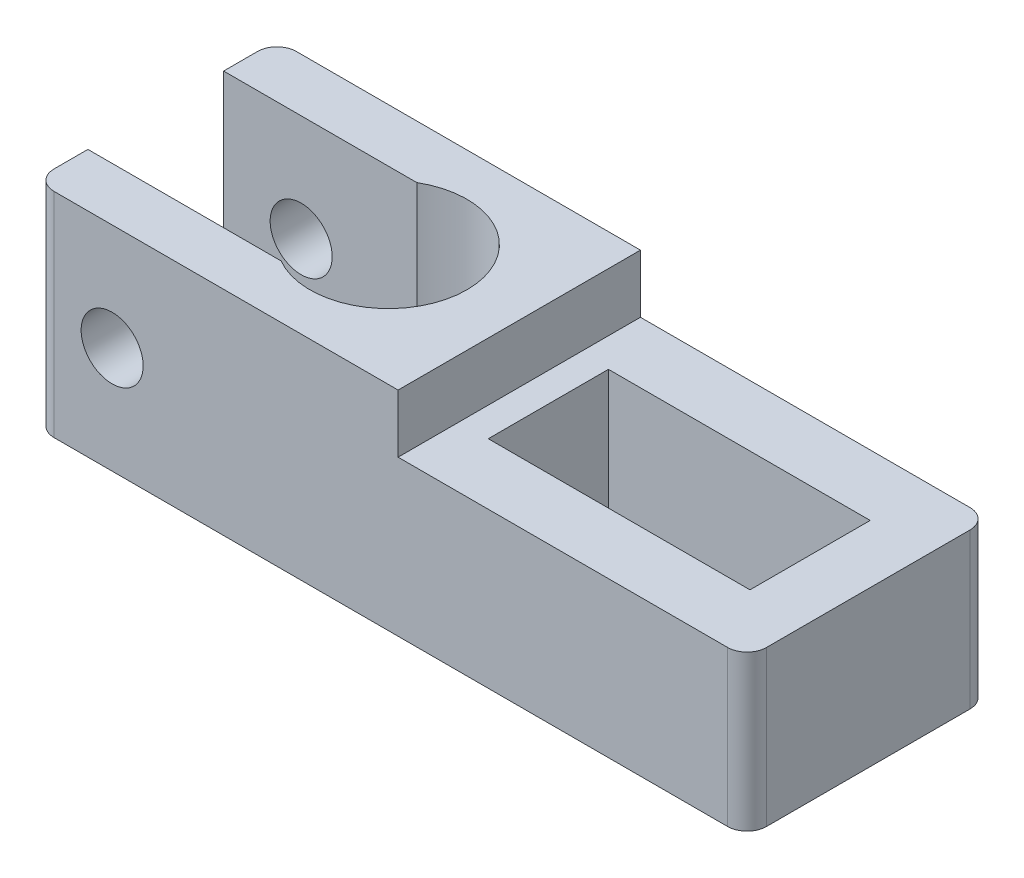
from build123d import *

# Parameters (mm, degrees)
SKETCH1_W           = 13.5
SKETCH1_H           = 6.2
BOSS_EXTRUDE1_DEPTH = 11
SKETCH2_R           = 1.6
CUT_EXTRUDE1_DEPTH  = 30.829725108
FILLET1_R           = 1
SKETCH3_W           = 18
SKETCH3_H           = 3
CUT_EXTRUDE2_DEPTH  = 30.829725108


with BuildPart() as part:
    # Sketch1 → Boss-Extrude1 (new body)
    with BuildSketch(Plane(origin=(0, 0, 0), x_dir=(1, 0, 0), z_dir=(0, 1, 0))):
        with BuildLine():
            Line((-12, -6.25), (24.75, -6.25))
            Line((24.75, -6.25), (24.75, 6.25))
            Line((24.75, 6.25), (-12, 6.25))
            Line((-12, 6.25), (-12, 3.5))
            Line((-12, 3.5), (-2.037768387, 3.5))
            ThreePointArc((-2.037768387, 3.5), (2.018605711, 3.511086867), (4.05, 0))
            ThreePointArc((4.05, 0), (2.018605711, -3.511086867), (-2.037768387, -3.5))
            Line((-2.037768387, -3.5), (-12, -3.5))
            Line((-12, -3.5), (-12, -6.25))
        make_face()
        with Locations((15, 0)):
            Rectangle(SKETCH1_W, SKETCH1_H, mode=Mode.SUBTRACT)
    extrude(amount=BOSS_EXTRUDE1_DEPTH)

    # Sketch2 → Cut-Extrude1 (cut, through all)
    with BuildSketch(Plane.XY.offset(6.25)):
        with Locations((-8, 5.5)):
            Circle(SKETCH2_R)
    extrude(amount=-CUT_EXTRUDE1_DEPTH, mode=Mode.SUBTRACT)

    # Fillet1
    fillet1_edges = [part.edges().sort_by_distance(p)[0] for p in [
        (-12, 5.5, -6.25),
        (24.75, 5.5, -6.25),
        (24.75, 5.5, 6.25),
        (-12, 5.5, 6.25),
    ]]
    fillet(fillet1_edges, radius=FILLET1_R)

    # Sketch3 → Cut-Extrude2 (cut, through all)
    with BuildSketch(Plane.XY.offset(6.25)):
        with Locations((15.75, 9.5)):
            Rectangle(SKETCH3_W, SKETCH3_H)
    extrude(amount=-CUT_EXTRUDE2_DEPTH, mode=Mode.SUBTRACT)


solid = part.part
